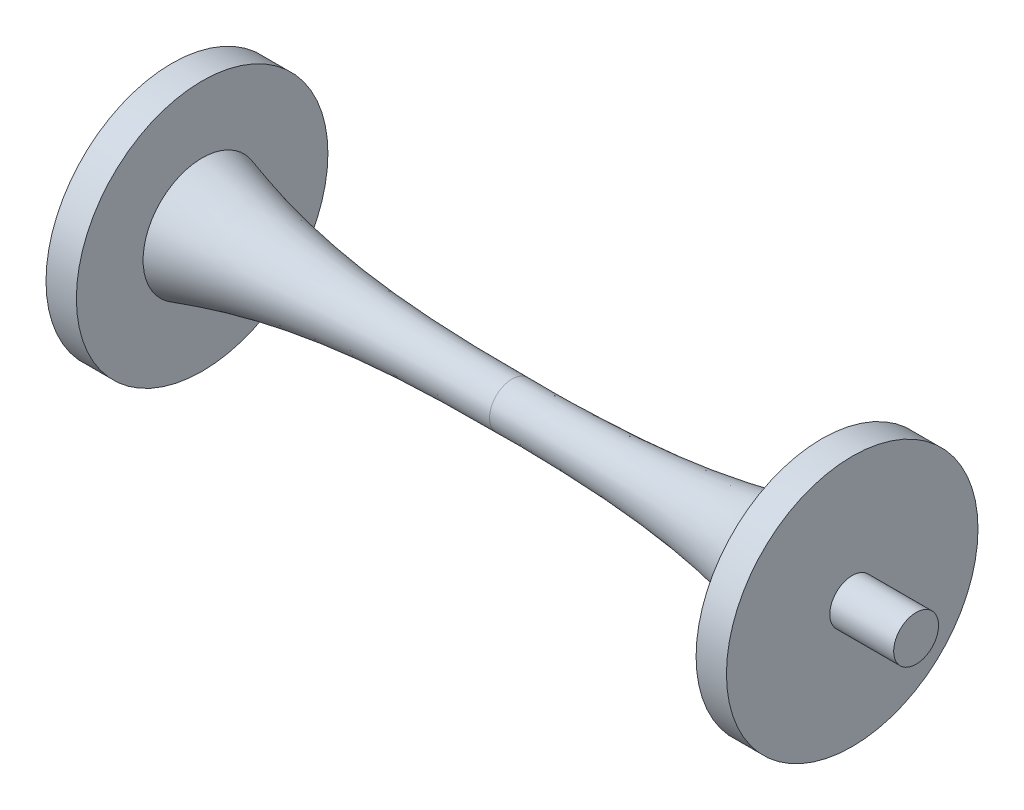
from build123d import *


with BuildPart() as part:
    # Sketch1 → Revolve1 (revolve)
    with BuildSketch(Plane(origin=(0, 0, 0), x_dir=(1, 0, 0), z_dir=(0, 1, 0))):
        with BuildLine():
            Line((-50, 10.152284264), (-50, 3.299492386))
            Line((-50, 3.299492386), (-59.390862944, 3.299492386))
            Line((-59.390862944, 3.299492386), (-59.390862944, 0))
            Line((-59.390862944, 0), (59.390862944, 0))
            Line((59.390862944, 0), (59.390862944, 3.299492386))
            Line((59.390862944, 3.299492386), (50, 3.299492386))
            Line((50, 3.299492386), (50, 10.152284264))
            Line((50, 10.152284264), (50, 18.484379762))
            Line((50, 18.484379762), (45.53834268, 18.484379762))
            Line((45.53834268, 18.484379762), (45.53834268, 8.678003166))
            add(Edge.make_bspline(
                [(0, 3.299492386), (14.134308112, 3.247838543), (28.352749593, 3.964388507), (42.936088831, 7.876240038), (45.53834268, 8.678003166)],
                knots=[0, 0, 0, 0, 0.749456369, 0.909412715, 0.909412715, 0.909412715, 0.909412715], degree=3))
            add(Edge.make_bspline(
                [(0, 3.299492386), (-14.134308112, 3.247838543), (-28.352749592, 3.964388507), (-42.936088831, 7.876240038), (-45.53834268, 8.678003166)],
                knots=[0, 0, 0, 0, 0.749456369, 0.909412715, 0.909412715, 0.909412715, 0.909412715], degree=3))
            Line((-45.53834268, 8.678003166), (-45.53834268, 18.484379762))
            Line((-45.53834268, 18.484379762), (-50, 18.484379762))
            Line((-50, 18.484379762), (-50, 10.152284264))
        make_face()
    revolve(axis=Axis((0, 0, 0), (-1, 0, 0)))


solid = part.part
